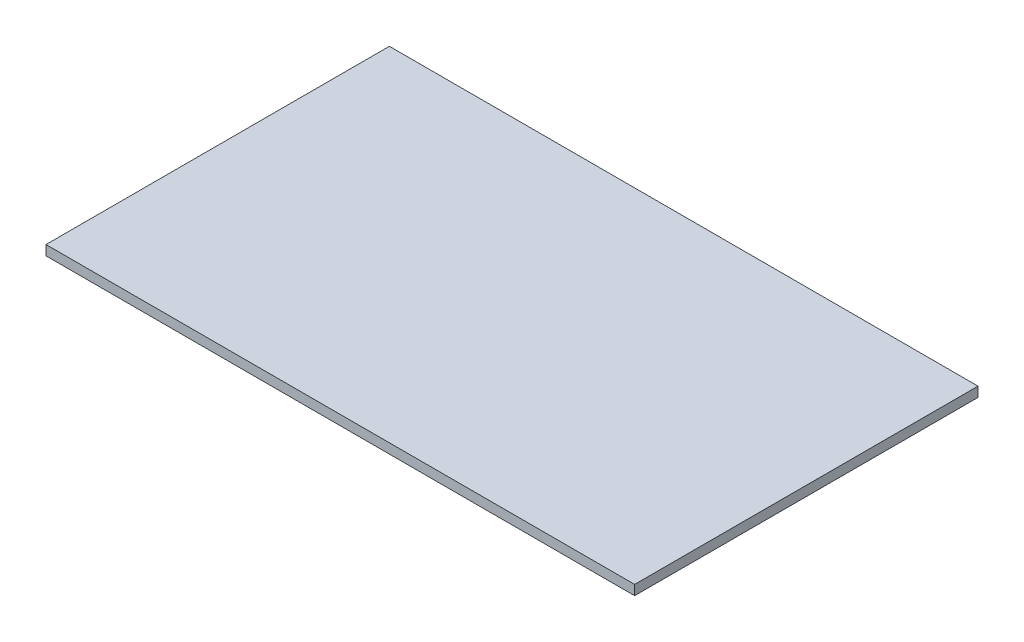
from build123d import *

# Parameters (mm, degrees)
SKETCH1_W           = 600
SKETCH1_H           = 350
BOSS_EXTRUDE1_DEPTH = 10


with BuildPart() as part:
    # Sketch1 → Boss-Extrude1 (new body)
    with BuildSketch(Plane(origin=(0, 0, 0), x_dir=(1, 0, 0), z_dir=(0, 1, 0))):
        Rectangle(SKETCH1_W, SKETCH1_H)
    extrude(amount=BOSS_EXTRUDE1_DEPTH)


solid = part.part
